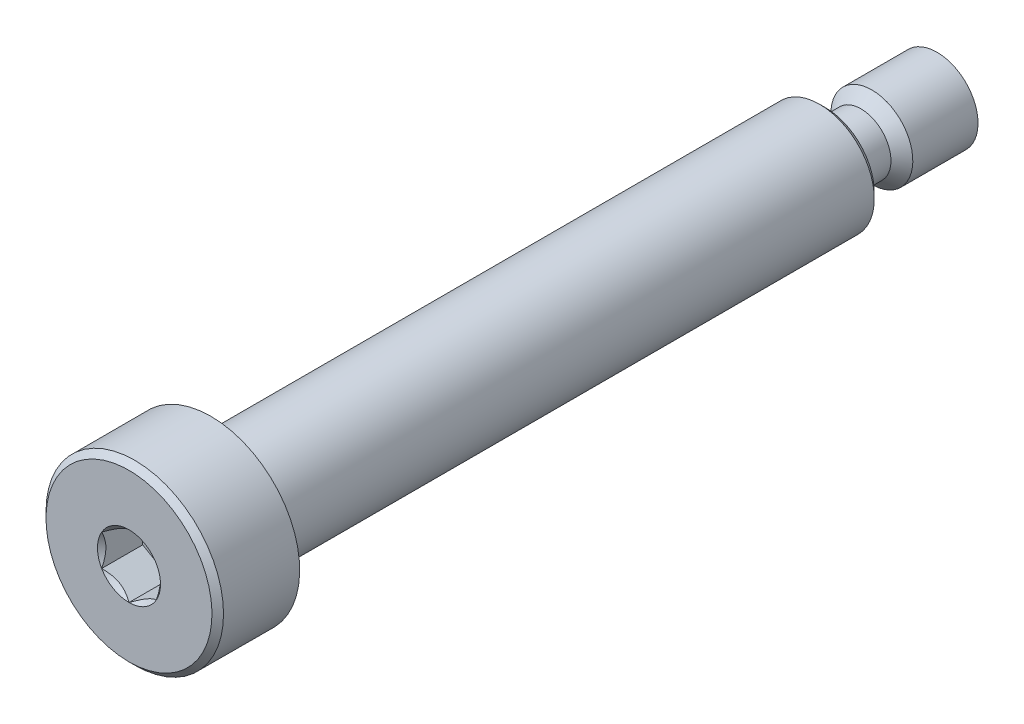
from build123d import *

# Parameters (mm, degrees)
SKETCH4_W          = 0.866666667
SKETCH4_H          = 0.866666667
CHAMFER1_SIZE      = 0.26
CHAMFER2_SIZE      = 0.75
CHAMFER3_SIZE      = 0.4225
CUT_EXTRUDE1_DEPTH = 3
SKETCH15_R         = 4
CUT_EXTRUDE3_DEPTH = 2.825


with BuildPart() as part:
    # Sketch3 → Revolve1 (revolve)
    with BuildSketch(Plane(origin=(0, 0, 0), x_dir=(0, 0, -1), z_dir=(1, 0, 0))):
        Polygon((-31, 6.5), (-25, 6.5), (-25, 4), (20, 4), (20, 3), (31, 3), (31, 0), (-31, 0), align=None)
    revolve(axis=Axis((0, 0, -31), (0, 0, 1)))

    # Sketch4 → Cut-Revolve1 (revolve, cut)
    with BuildSketch(Plane(origin=(0, 0, 0), x_dir=(0, 0, -1), z_dir=(1, 0, 0))):
        with Locations((-24.566666667, 3.566666667)):
            Rectangle(SKETCH4_W, SKETCH4_H)
    revolve(axis=Axis((0, 0, -31), (0, 0, 1)), mode=Mode.SUBTRACT)

    # Chamfer1
    chamfer1_edges = [part.edges().sort_by_distance(p)[0] for p in [
        (0, -3.133333333, 24.133333333),
        (0, -4, 24.133333333),
    ]]
    chamfer(chamfer1_edges, length=CHAMFER1_SIZE)

    # Sketch6 → Cut-Revolve2 (revolve, cut)
    with BuildSketch(Plane(origin=(0, 0, 0), x_dir=(0, 0, -1), z_dir=(1, 0, 0))):
        with BuildLine():
            Line((20, 4), (24.4, 4))
            Line((24.4, 4), (22.6, 2.2))
            Line((22.6, 2.2), (20.8, 2.2))
            ThreePointArc((20.8, 2.2), (20.234314575, 2.434314575), (20, 3))
            Line((20, 3), (20, 4))
        make_face()
    revolve(axis=Axis((0, 0, -31), (0, 0, 1)), mode=Mode.SUBTRACT)

    # Chamfer2
    chamfer2_edges = [part.edges().sort_by_distance(p)[0] for p in [
        (0, -3, -31),
    ]]
    chamfer(chamfer2_edges, length=CHAMFER2_SIZE)

    # Chamfer3
    chamfer3_edges = [part.edges().sort_by_distance(p)[0] for p in [
        (0, -4, -20),
        (0, -6.5, 31),
    ]]
    chamfer(chamfer3_edges, length=CHAMFER3_SIZE)

    # Sketch8 → Cut-Extrude1 (cut)
    with BuildSketch(Plane.XY.offset(31)):
        Polygon((2, 1.154700538), (0, 2.309401077), (-2, 1.154700538), (-2, -1.154700538), (0, -2.309401077), (2, -1.154700538), align=None)
    extrude(amount=-CUT_EXTRUDE1_DEPTH, mode=Mode.SUBTRACT)

    # Cut-Extrude2 cone 1 section (through the dimple's axis) → Cut-Extrude2 (revolve, cut)
    with BuildSketch(Plane(origin=(0, 0, 31), x_dir=(0, -1, 0), z_dir=(1, 0, 0))):
        Polygon((0, 0), (2.309401077, 0), (0, 2.309401077), align=None)
    revolve(axis=Axis((0, 0, 31), (0, 0, -1)), mode=Mode.SUBTRACT)

    # Sketch15 → Cut-Extrude3 (cut)
    with BuildSketch(Plane(origin=(0, 0, -31), x_dir=(-1, 0, 0), z_dir=(0, 0, -1))):
        with Locations(Location((0, 0, 0), (0, 0, 90))):
            Circle(SKETCH15_R)
    extrude(amount=-CUT_EXTRUDE3_DEPTH, mode=Mode.SUBTRACT)


solid = part.part
